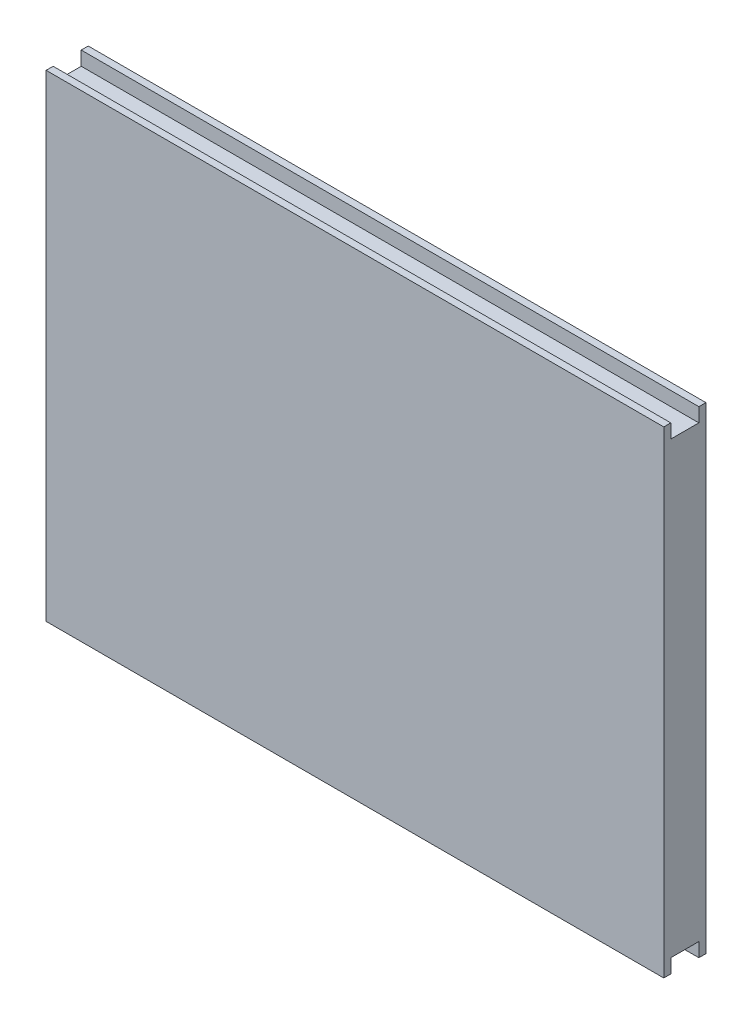
from build123d import *

# Parameters (mm, degrees)
EXTRUDE_1_DEPTH = 220


with BuildPart() as part:
    # 草图1 → 凸台-拉伸1 (new body)
    with BuildSketch(Plane(origin=(0, 0, 0), x_dir=(0, 0, -1), z_dir=(1, 0, 0))):
        Polygon((-5, 85), (-5, 80), (5, 80), (5, 85), (7.5, 85), (7.5, -85), (5, -85), (5, -80), (-5, -80), (-5, -85), (-7.5, -85), (-7.5, 85), align=None)
    extrude(amount=EXTRUDE_1_DEPTH)


solid = part.part
